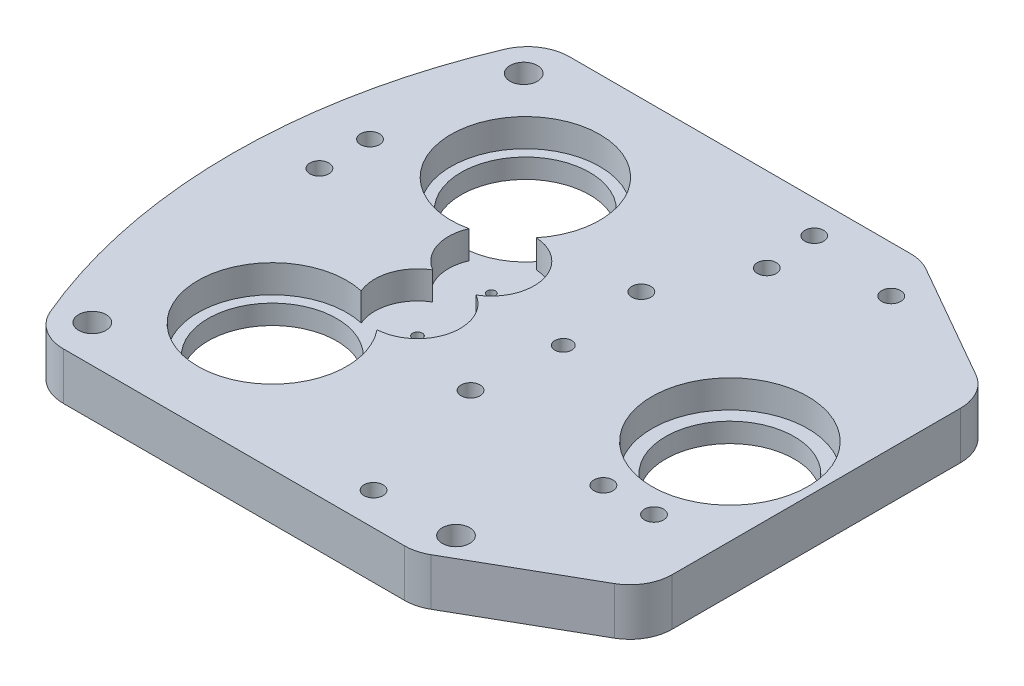
from build123d import *

# Parameters (mm, degrees)
SKETCH1_W                        = 125
SKETCH1_H                        = 120
TEST_BASE_POSTION_DEPTH          = 11.215
SKETCH10_R                       = 15.25
CONNECT_FINGER_HOLES_DEPTH       = 98.597363925
SKETCH11_R                       = 18.5
XL320_FINGER_KNUCKLE_MOUNT_DEPTH = 6.6025
SKETCH24_R                       = 2.25
AX12_MOUNT_HOLES_M4_DEPTH        = 98.597363925
SKETCH21_R                       = 17.65
SKETCH21_R_2                     = 10.15
GEARS_HOLES_DEPTH                = 6.6025
SKETCH22_R                       = 1.15
GEARS_ROD_HOLES_DEPTH            = 3
CUT_EXTRUDE1_DEPTH               = 98.597363925
FILLET1_R                        = 10
SKETCH17_R                       = 3.25
CONNECT_HOLES_M6_DEPTH           = 98.597363925
NUTS_M6_DEPTH                    = 6
NUTS_M4_DEPTH                    = 5
SKETCH30_R                       = 2
CONNECT_TO_HOUSE_DEPTH           = 98.597363925
SKETCH31_R                       = 2.25
M4_EXTENSION_HOLE_DEPTH          = 5
SKETCH28_R                       = 1
M2_SHAFT_HOLE_DEPTH              = 3


with BuildPart() as part:
    # Sketch1 → Test_Base_Postion (new body)
    with BuildSketch(Plane(origin=(0, 0, 0), x_dir=(1, 0, 0), z_dir=(0, 1, 0))):
        with BuildLine():
            ThreePointArc((-62.5, 60), (-76.154246239, 0), (-62.5, -60))
            Line((-62.5, -60), (-62.5, 60))
        make_face()
        Rectangle(SKETCH1_W, SKETCH1_H)
    extrude(amount=TEST_BASE_POSTION_DEPTH)

    # Sketch10 → Connect_Finger_Holes (cut, through all)
    with BuildSketch(Plane(origin=(0, 11.215, 0), x_dir=(1, 0, 0), z_dir=(0, 1, 0))):
        with Locations(Location((-36.5, 30, 0), (0, 0, 270))):
            Circle(SKETCH10_R)
        with Locations(Location((-36.5, -30, 0), (0, 0, 270))):
            Circle(SKETCH10_R)
        with Locations(Location((42, 0, 0), (0, 0, 270))):
            Circle(SKETCH10_R)
    extrude(amount=-CONNECT_FINGER_HOLES_DEPTH, mode=Mode.SUBTRACT)

    # Sketch11 → XL320_Finger_Knuckle_Mount (cut)
    with BuildSketch(Plane(origin=(0, 11.215, 0), x_dir=(1, 0, 0), z_dir=(0, 1, 0))):
        with Locations(Location((42, 0, 0), (0, 0, 270))):
            Circle(SKETCH11_R)
    extrude(amount=-XL320_FINGER_KNUCKLE_MOUNT_DEPTH, mode=Mode.SUBTRACT)

    # Sketch24 → AX12_Mount_Holes_(M4) (cut, through all)
    with BuildSketch(Plane(origin=(0, 11.215, 0), x_dir=(1, 0, 0), z_dir=(0, 1, 0))):
        with Locations(Location((9.75, 52.25, 0), (0, 0, 270))):
            Circle(SKETCH24_R)
        with Locations(Location((0.75, 20.25, 0), (0, 0, 270))):
            Circle(SKETCH24_R)
        with Locations(Location((0.75, -20.25, 0), (0, 0, 270))):
            Circle(SKETCH24_R)
        with Locations(Location((9.75, -52.25, 0), (0, 0, 270))):
            Circle(SKETCH24_R)
        with Locations(Location((10.75, 40, 0), (0, 0, 270))):
            Circle(SKETCH24_R)
        with Locations(Location((31.25, 49, 0), (0, 0, 270))):
            Circle(SKETCH24_R)
    extrude(amount=-AX12_MOUNT_HOLES_M4_DEPTH, mode=Mode.SUBTRACT)

    # Sketch21 → Gears_Holes (cut)
    with BuildSketch(Plane(origin=(0, 11.215, 0), x_dir=(1, 0, 0), z_dir=(0, 1, 0))):
        with Locations((-36.5, 30)):
            Circle(SKETCH21_R)
        with Locations((-23.330432809, 8.75)):
            Circle(SKETCH21_R_2)
        with Locations((-23.330432809, -8.75)):
            Circle(SKETCH21_R_2)
        with Locations((-36.5, -30)):
            Circle(SKETCH21_R)
    extrude(amount=-GEARS_HOLES_DEPTH, mode=Mode.SUBTRACT)

    # Sketch22 → Gears_Rod_Holes (cut)
    with BuildSketch(Plane(origin=(0, 4.6125, 0), x_dir=(1, 0, 0), z_dir=(0, 1, 0))):
        with Locations(Location((-23.330432809, -8.75, 0), (0, 0, 270))):
            Circle(SKETCH22_R)
    extrude(amount=-GEARS_ROD_HOLES_DEPTH, mode=Mode.SUBTRACT)

    # Sketch29 → Cut-Extrude1 (cut, through all)
    with BuildSketch(Plane(origin=(0, 11.215, 0), x_dir=(1, 0, 0), z_dir=(0, 1, 0))):
        Polygon((27.5, 60), (62.5, 40), (62.5, 60), align=None)
        Polygon((62.5, -60), (27.5, -60), (62.5, -40), align=None)
    extrude(amount=-CUT_EXTRUDE1_DEPTH, mode=Mode.SUBTRACT)

    # Fillet1
    fillet1_edges = [part.edges().sort_by_distance(p)[0] for p in [
        (62.5, 5.6075, 40),
        (27.5, 5.6075, 60),
        (-62.5, 5.6075, -60),
        (-62.5, 5.6075, 60),
        (27.5, 5.6075, -60),
        (62.5, 5.6075, -40),
    ]]
    fillet(fillet1_edges, radius=FILLET1_R)

    # Sketch17 → Connect_Holes_(M6) (cut, through all)
    with BuildSketch(Plane(origin=(0, 11.215, 0), x_dir=(1, 0, 0), z_dir=(0, 1, 0))):
        with Locations(Location((-58.040773893, 51.152938298, 0), (0, 0, 270))):
            Circle(SKETCH17_R)
        with Locations(Location((-58.040773893, -51.152938298, 0), (0, 0, 270))):
            Circle(SKETCH17_R)
        with Locations(Location((28.844355629, -51.794444289, 0), (0, 0, 270))):
            Circle(SKETCH17_R)
    extrude(amount=-CONNECT_HOLES_M6_DEPTH, mode=Mode.SUBTRACT)

    # Sketch19 → Nuts_(M6) (cut)
    with BuildSketch(Plane.XZ):
        Polygon((-58.040773893, 56.92644099), (-63.040773893, 54.039689644), (-63.040773893, 48.266186952), (-58.040773893, 45.379435606), (-53.040773893, 48.266186952), (-53.040773893, 54.039689644), align=None)
        Polygon((28.844355629, 57.56794698), (23.844355629, 54.681195634), (23.844355629, 48.907692943), (28.844355629, 46.020941597), (33.844355629, 48.907692943), (33.844355629, 54.681195634), align=None)
        Polygon((-58.040773893, -45.379435606), (-63.040773893, -48.266186952), (-63.040773893, -54.039689644), (-58.040773893, -56.92644099), (-53.040773893, -54.039689644), (-53.040773893, -48.266186952), align=None)
    extrude(amount=-NUTS_M6_DEPTH, mode=Mode.SUBTRACT)

    # Sketch27 → Nuts_(M4) (cut)
    with BuildSketch(Plane.XZ):
        Polygon((9.75, 56.291451884), (6.25, 54.270725942), (6.25, 50.229274058), (9.75, 48.208548116), (13.25, 50.229274058), (13.25, 54.270725942), align=None)
        Polygon((-2.75, 22.270725942), (-2.75, 18.229274058), (0.75, 16.208548116), (4.25, 18.229274058), (4.25, 22.270725942), (0.75, 24.291451884), align=None)
        Polygon((-2.75, -22.270725942), (0.75, -24.291451884), (4.25, -22.270725942), (4.25, -18.229274058), (0.75, -16.208548116), (-2.75, -18.229274058), align=None)
        Polygon((6.25, -50.229274058), (6.25, -54.270725942), (9.75, -56.291451884), (13.25, -54.270725942), (13.25, -50.229274058), (9.75, -48.208548116), align=None)
        Polygon((14.25, -37.979274058), (10.75, -35.958548116), (7.25, -37.979274058), (7.25, -42.020725942), (10.75, -44.041451884), (14.25, -42.020725942), align=None)
        Polygon((27.75, -46.979274058), (27.75, -51.020725942), (31.25, -53.041451884), (34.75, -51.020725942), (34.75, -46.979274058), (31.25, -44.958548116), align=None)
    extrude(amount=-NUTS_M4_DEPTH, mode=Mode.SUBTRACT)

    # Sketch30 → Connect_To_House (cut, through all)
    with BuildSketch(Plane(origin=(0, 11.215, 0), x_dir=(1, 0, 0), z_dir=(0, 1, 0))):
        with Locations(Location((2.5, 0, 0), (0, 0, 270))):
            Circle(SKETCH30_R)
    extrude(amount=-CONNECT_TO_HOUSE_DEPTH, mode=Mode.SUBTRACT)

    # Sketch31 → M4_Extension_Hole (cut)
    with BuildSketch(Plane(origin=(0, 11.215, 0), x_dir=(1, 0, 0), z_dir=(0, 1, 0))):
        with Locations(Location((-62.75, 19.41386581, 0), (0, 0, 270))):
            Circle(SKETCH31_R)
        with Locations(Location((-62.75, 7.41386581, 0), (0, 0, 270))):
            Circle(SKETCH31_R)
        with Locations(Location((36, -24, 0), (0, 0, 270))):
            Circle(SKETCH31_R)
        with Locations(Location((48, -24, 0), (0, 0, 270))):
            Circle(SKETCH31_R)
    extrude(amount=-M4_EXTENSION_HOLE_DEPTH, mode=Mode.SUBTRACT)

    # Sketch28 → M2_Shaft_Hole (cut)
    with BuildSketch(Plane(origin=(0, 4.6125, 0), x_dir=(1, 0, 0), z_dir=(0, 1, 0))):
        with Locations(Location((-23.330432809, 8.75, 0), (0, 0, 270))):
            Circle(SKETCH28_R)
    extrude(amount=-M2_SHAFT_HOLE_DEPTH, mode=Mode.SUBTRACT)


solid = part.part
